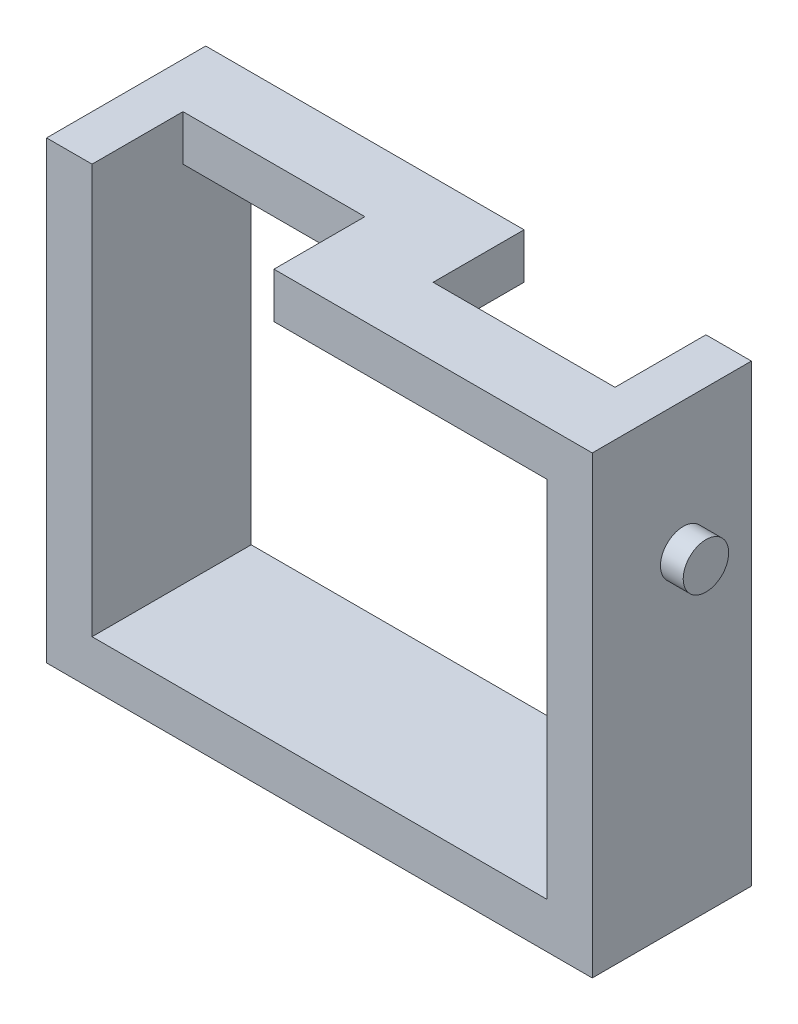
from build123d import *

# Parameters (mm, degrees)
SKETCH1_W           = 60
SKETCH1_H           = 50
BOSS_EXTRUDE1_DEPTH = 30
SKETCH2_W           = 50
SKETCH2_H           = 40
CUT_EXTRUDE1_DEPTH  = 58.226541049
SKETCH3_W           = 20
SKETCH3_H           = 22.5
CUT_EXTRUDE2_DEPTH  = 5
SKETCH4_W           = 20
SKETCH4_H           = 10
CUT_EXTRUDE3_DEPTH  = 10
SKETCH5_W           = 62.459499436
SKETCH5_H           = 12.5
CUT_EXTRUDE4_DEPTH  = 68.007244418
SKETCH6_R           = 2.5
BOSS_EXTRUDE2_DEPTH = 2.5
BOSS_EXTRUDE3_START = 2.5
SKETCH7_R           = 2.5
BOSS_EXTRUDE3_DEPTH = 2.5


with BuildPart() as part:
    # Sketch1 → Boss-Extrude1 (new body)
    with BuildSketch(Plane.XY):
        with Locations((3.014705882, -10.845588235)):
            Rectangle(SKETCH1_W, SKETCH1_H)
    extrude(amount=BOSS_EXTRUDE1_DEPTH)

    # Sketch2 → Cut-Extrude1 (cut, through all)
    with BuildSketch(Plane.XY.offset(30)):
        with Locations((3.014705882, -10.845588235)):
            Rectangle(SKETCH2_W, SKETCH2_H)
    extrude(amount=-CUT_EXTRUDE1_DEPTH, mode=Mode.SUBTRACT)

    # Sketch3 → Cut-Extrude2 (cut)
    with BuildSketch(Plane(origin=(0, 14.154411765, 0), x_dir=(1, 0, 0), z_dir=(0, 1, 0))):
        with Locations((18.014705882, -11.25)):
            Rectangle(SKETCH3_W, SKETCH3_H)
    extrude(amount=-CUT_EXTRUDE2_DEPTH, mode=Mode.SUBTRACT)

    # Sketch4 → Cut-Extrude3 (cut)
    with BuildSketch(Plane(origin=(0, 14.154411765, 0), x_dir=(1, 0, 0), z_dir=(0, 1, 0))):
        with Locations((-11.985294118, -25)):
            Rectangle(SKETCH4_W, SKETCH4_H)
    extrude(amount=-CUT_EXTRUDE3_DEPTH, mode=Mode.SUBTRACT)

    # Sketch5 → Cut-Extrude4 (cut, through all)
    with BuildSketch(Plane(origin=(0, 14.154411765, 0), x_dir=(1, 0, 0), z_dir=(0, 1, 0))):
        with Locations((2.876613087, -6.25)):
            Rectangle(SKETCH5_W, SKETCH5_H)
    extrude(amount=-CUT_EXTRUDE4_DEPTH, mode=Mode.SUBTRACT)

    # Sketch6 → Boss-Extrude2 (add)
    with BuildSketch(Plane(origin=(33.014705882, 0, 0), x_dir=(0, 0, -1), z_dir=(1, 0, 0))):
        with Locations(Location((-20, -0.345588235, 0), (0, 0, 180))):
            Circle(SKETCH6_R)
    extrude(amount=BOSS_EXTRUDE2_DEPTH)

    # Sketch7 → Boss-Extrude3 (add)
    with BuildSketch(Plane.ZY.offset(26.985294118).offset(BOSS_EXTRUDE3_START)):
        with Locations((20, -0.345588235)):
            Circle(SKETCH7_R)
    extrude(amount=-BOSS_EXTRUDE3_DEPTH)


solid = part.part
